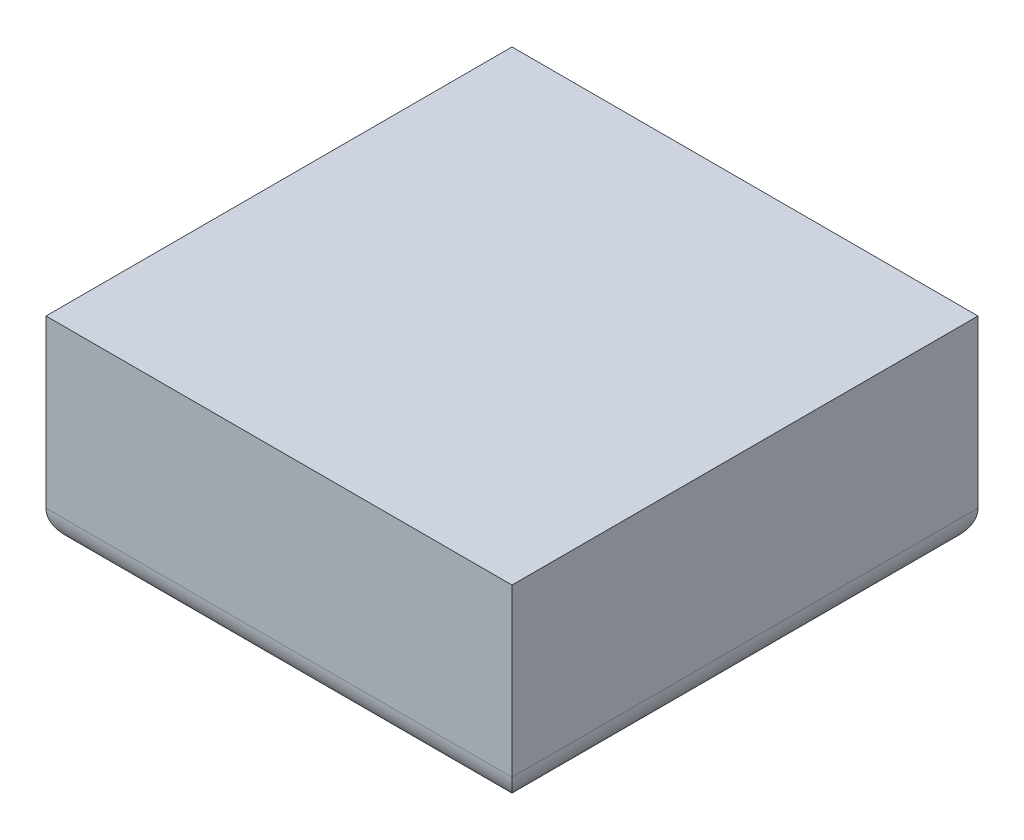
from build123d import *

# Parameters (mm, degrees)
SKETCH1_W           = 70
SKETCH1_H           = 70
BOSS_EXTRUDE1_DEPTH = 30
FILLET1_R           = 5


with BuildPart() as part:
    # Sketch1 → Boss-Extrude1 (new body)
    with BuildSketch(Plane(origin=(0, 0, 0), x_dir=(1, 0, 0), z_dir=(0, 1, 0))):
        with Locations((35, 35)):
            Rectangle(SKETCH1_W, SKETCH1_H)
    extrude(amount=BOSS_EXTRUDE1_DEPTH)

    # Fillet1
    fillet1_edges = [part.edges().sort_by_distance(p)[0] for p in [
        (35, 0, -70),
        (70, 0, -35),
        (35, 0, 0),
        (0, 0, -35),
    ]]
    fillet(fillet1_edges, radius=FILLET1_R)


solid = part.part
